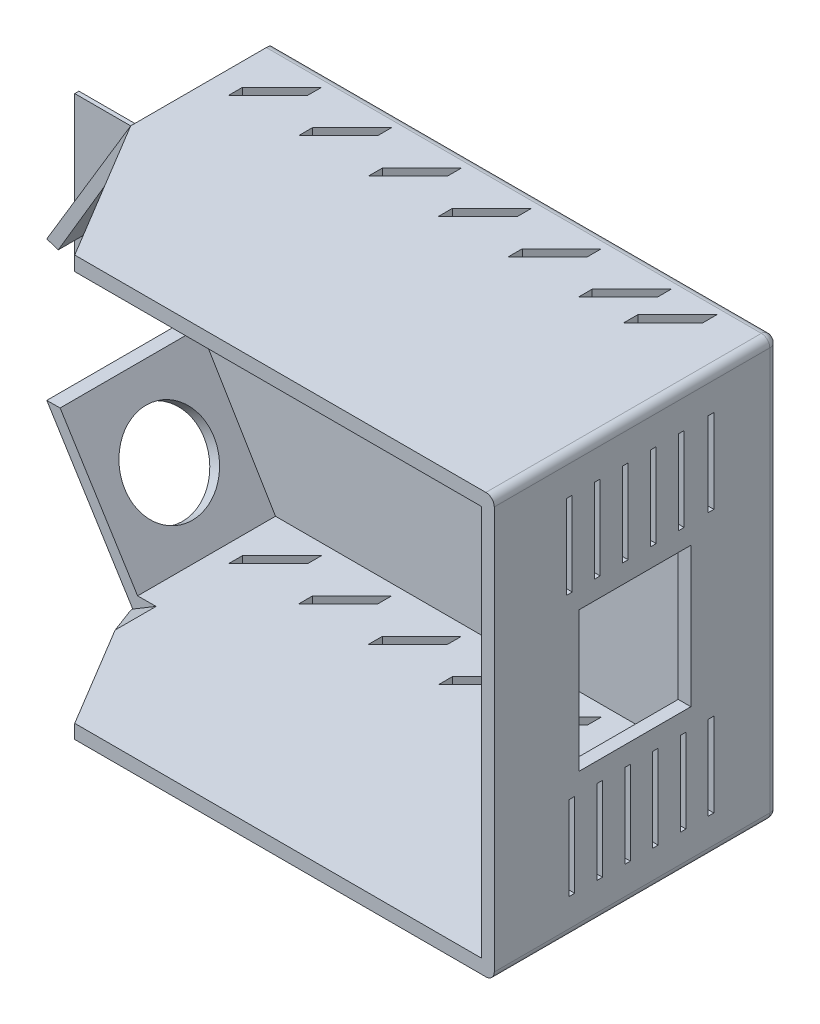
from build123d import *

# Parameters (mm, degrees)
SKETCH_1_W           = 250
SKETCH_1_H           = 150
EXTRUDE_1_DEPTH      = 1.5
SKETCH_2_W           = 40
SKETCH_2_H           = 50
CUT_EXTRUDE_1_DEPTH  = 233.650381036
SKETCH_3_W           = 40
SKETCH_3_H           = 50
CUT_EXTRUDE_2_DEPTH  = 233.650381036
CUT_EXTRUDE_3_DEPTH  = 233.650381036
SKETCH_5_W           = 100
SKETCH_5_H           = 10
CUT_EXTRUDE_4_DEPTH  = 233.650381036
EXTRUDE_2_DEPTH      = 100
EXTRUDE_3_DEPTH      = 100
CUT_EXTRUDE_5_DEPTH  = 268.016260599
CUT_EXTRUDE_7_DEPTH  = 10
SKETCH_14_W          = 50
SKETCH_14_H          = 58.309518949
CUT_EXTRUDE_10_DEPTH = 10
SKETCH_15_R          = 16
CUT_EXTRUDE_11_DEPTH = 10
CUT_EXTRUDE_14_DEPTH = 268.016260599
SKETCH_20_W          = 40
SKETCH_20_H          = 50
CUT_EXTRUDE_15_DEPTH = 10
FILLET_1_R           = 3
SKETCH_21_W          = 2
SKETCH_21_H          = 30
CUT_EXTRUDE_16_DEPTH = 10


with BuildPart() as part:
    # 草图1 → 凸台-拉伸1 (new body)
    with BuildSketch(Plane.XY):
        with Locations((71.202531646, -50.014064698)):
            Rectangle(SKETCH_1_W, SKETCH_1_H)
    extrude(amount=EXTRUDE_1_DEPTH)

    # 草图2 → 切除-拉伸1 (cut, through all)
    with BuildSketch(Plane.XY.offset(1.5)):
        with Locations((-33.797468354, -0.014064698)):
            Rectangle(SKETCH_2_W, SKETCH_2_H)
    extrude(amount=-CUT_EXTRUDE_1_DEPTH, mode=Mode.SUBTRACT)

    # 草图3 → 切除-拉伸2 (cut, through all)
    with BuildSketch(Plane.XY.offset(1.5)):
        with Locations((-33.797468354, -100.014064698)):
            Rectangle(SKETCH_3_W, SKETCH_3_H)
    extrude(amount=-CUT_EXTRUDE_2_DEPTH, mode=Mode.SUBTRACT)

    # 草图4 → 切除-拉伸3 (cut, through all)
    with BuildSketch(Plane.XY.offset(1.5)):
        Polygon((-13.797468354, -75.014064698), (16.202531646, -125.014064698), (-13.797468354, -125.014064698), align=None)
        Polygon((-13.797468354, -25.014064698), (16.202531646, 24.985935302), (-13.797468354, 24.985935302), align=None)
    extrude(amount=-CUT_EXTRUDE_3_DEPTH, mode=Mode.SUBTRACT)

    # 草图5 → 切除-拉伸4 (cut, through all)
    with BuildSketch(Plane.XY.offset(1.5)):
        with Locations((96.202531646, -60.014064698)):
            Rectangle(SKETCH_5_W, SKETCH_5_H)
        with Locations((96.202531646, -40.014064698)):
            Rectangle(SKETCH_5_W, SKETCH_5_H)
    extrude(amount=-CUT_EXTRUDE_4_DEPTH, mode=Mode.SUBTRACT)

    # 草图6 → 凸台-拉伸2 (add)
    with BuildSketch(Plane.XY.offset(1.5)):
        Polygon((-13.797468354, -75.014064698), (-9.06108927, -75.014064698), (17.975201528, -120.010528641), (191.672994216, -120.010528641), (191.672994216, 24.985935302), (196.202531646, 24.985935302), (196.202531646, -125.014064698), (16.202531646, -125.014064698), align=None)
    extrude(amount=EXTRUDE_2_DEPTH)

    # 草图7 → 凸台-拉伸3 (add)
    with BuildSketch(Plane.XY.offset(1.5)):
        Polygon((-9.70187004, -26.373391519), (17.639126857, 19.845802477), (191.672994216, 19.845802477), (191.672994216, 24.985935302), (16.202531646, 24.985935302), (-13.797468354, -25.014064698), align=None)
    extrude(amount=EXTRUDE_3_DEPTH)

    # 草图8 → 切除-拉伸5 (cut, through all)
    with BuildSketch(Plane(origin=(0, 24.985935302, 0), x_dir=(1, 0, 0), z_dir=(0, 1, 0))):
        Polygon((179.466999768, -10.18289615), (165.324864144, -24.325031774), (165.324864144, -19.325031774), (179.466999768, -5.18289615), align=None)
        Polygon((163.399705406, -10.407679967), (149.257569782, -24.549815591), (149.257569782, -19.549815591), (163.399705406, -5.407679967), align=None)
        Polygon((124.257569782, -24.549815591), (124.257569782, -19.549815591), (138.399705406, -5.407679967), (138.399705406, -10.407679967), align=None)
        Polygon((99.257569782, -24.549815591), (99.257569782, -19.549815591), (113.399705406, -5.407679967), (113.399705406, -10.407679967), align=None)
        Polygon((74.257569782, -24.549815591), (74.257569782, -19.549815591), (88.399705406, -5.407679967), (88.399705406, -10.407679967), align=None)
        Polygon((49.257569782, -24.549815591), (49.257569782, -19.549815591), (63.399705406, -5.407679967), (63.399705406, -10.407679967), align=None)
        Polygon((24.257569782, -24.549815591), (24.257569782, -19.549815591), (38.399705406, -5.407679967), (38.399705406, -10.407679967), align=None)
    extrude(amount=-CUT_EXTRUDE_5_DEPTH, mode=Mode.SUBTRACT)

    # 草图11 → 切除-拉伸7 (cut)
    with BuildSketch(Plane(origin=(-43.239637627, -25.943782576, 0), x_dir=(0, 0, 1), z_dir=(-0.8574929257125441, -0.5144957554275268, 0))):
        Polygon((101.5, -57.225290903), (51.5, -57.225290903), (50.75, -115.534809852), (101.5, -115.534809852), align=None)
    extrude(amount=-CUT_EXTRUDE_7_DEPTH, mode=Mode.SUBTRACT)

    # 草图14 → 切除-拉伸10 (cut)
    with BuildSketch(Plane(origin=(0.890419459, -0.534251675, 0), x_dir=(0, 0, 1), z_dir=(-0.8574929257125442, 0.5144957554275266, 0))):
        with Locations((76.5, 0.606637048)):
            Rectangle(SKETCH_14_W, SKETCH_14_H)
    extrude(amount=-CUT_EXTRUDE_10_DEPTH, mode=Mode.SUBTRACT)

    # 草图15 → 切除-拉伸11 (cut)
    with BuildSketch(Plane(origin=(-43.239637627, -25.943782576, 0), x_dir=(0, 0, 1), z_dir=(-0.8574929257125441, -0.5144957554275268, 0))):
        with Locations(Location((26.124922648, -86.225290903, 0), (0, 0, 270))):
            Circle(SKETCH_15_R)
    extrude(amount=-CUT_EXTRUDE_11_DEPTH, mode=Mode.SUBTRACT)

    # 草图19 → 切除-拉伸14 (cut, through all)
    with BuildSketch(Plane(origin=(0, 24.985935302, 0), x_dir=(1, 0, 0), z_dir=(0, 1, 0))):
        Polygon((46.202531646, -101.5), (16.202531646, -51.5), (16.202531646, -101.5), align=None)
    extrude(amount=-CUT_EXTRUDE_14_DEPTH, mode=Mode.SUBTRACT)

    # 草图20 → 切除-拉伸15 (cut)
    with BuildSketch(Plane(origin=(196.202531646, 0, 0), x_dir=(0, 0, -1), z_dir=(1, 0, 0))):
        with Locations((-51.207849099, -50.014064698)):
            Rectangle(SKETCH_20_W, SKETCH_20_H)
    extrude(amount=-CUT_EXTRUDE_15_DEPTH, mode=Mode.SUBTRACT)

    # 圆角1
    fillet_1_edges = [part.edges().sort_by_distance(p)[0] for p in [
        (106.202531646, -125.014064698, 0),
        (106.202531646, 24.985935302, 0),
        (196.202531646, -50.014064698, 0),
        (196.202531646, 24.985935302, 50.75),
        (196.202531646, -125.014064698, 50.75),
    ]]
    fillet(fillet_1_edges, radius=FILLET_1_R)

    # 草图21 → 切除-拉伸16 (cut)
    with BuildSketch(Plane(origin=(196.202531646, 0, 0), x_dir=(0, 0, -1), z_dir=(1, 0, 0))):
        with Locations((-63.800605611, -97.014064698)):
            Rectangle(SKETCH_21_W, SKETCH_21_H)
        with Locations((-73.750757013, -97.014064698)):
            Rectangle(SKETCH_21_W, SKETCH_21_H)
        with Locations((-53.850454208, -97.014064698)):
            Rectangle(SKETCH_21_W, SKETCH_21_H)
        with Locations((-43.900302805, -97.014064698)):
            Rectangle(SKETCH_21_W, SKETCH_21_H)
        with Locations((-33.950151403, -97.014064698)):
            Rectangle(SKETCH_21_W, SKETCH_21_H)
        with Locations((-24, -97.014064698)):
            Rectangle(SKETCH_21_W, SKETCH_21_H)
        with Locations((-64.626123933, -3.300353784)):
            Rectangle(SKETCH_21_W, SKETCH_21_H)
        with Locations((-74.626123933, -3.300353784)):
            Rectangle(SKETCH_21_W, SKETCH_21_H)
        with Locations((-54.626123933, -3.300353784)):
            Rectangle(SKETCH_21_W, SKETCH_21_H)
        with Locations((-44.626123933, -3.300353784)):
            Rectangle(SKETCH_21_W, SKETCH_21_H)
        with Locations((-34.626123933, -3.300353784)):
            Rectangle(SKETCH_21_W, SKETCH_21_H)
        with Locations((-24, -3.014064698)):
            Rectangle(SKETCH_21_W, SKETCH_21_H)
    extrude(amount=-CUT_EXTRUDE_16_DEPTH, mode=Mode.SUBTRACT)


solid = part.part
